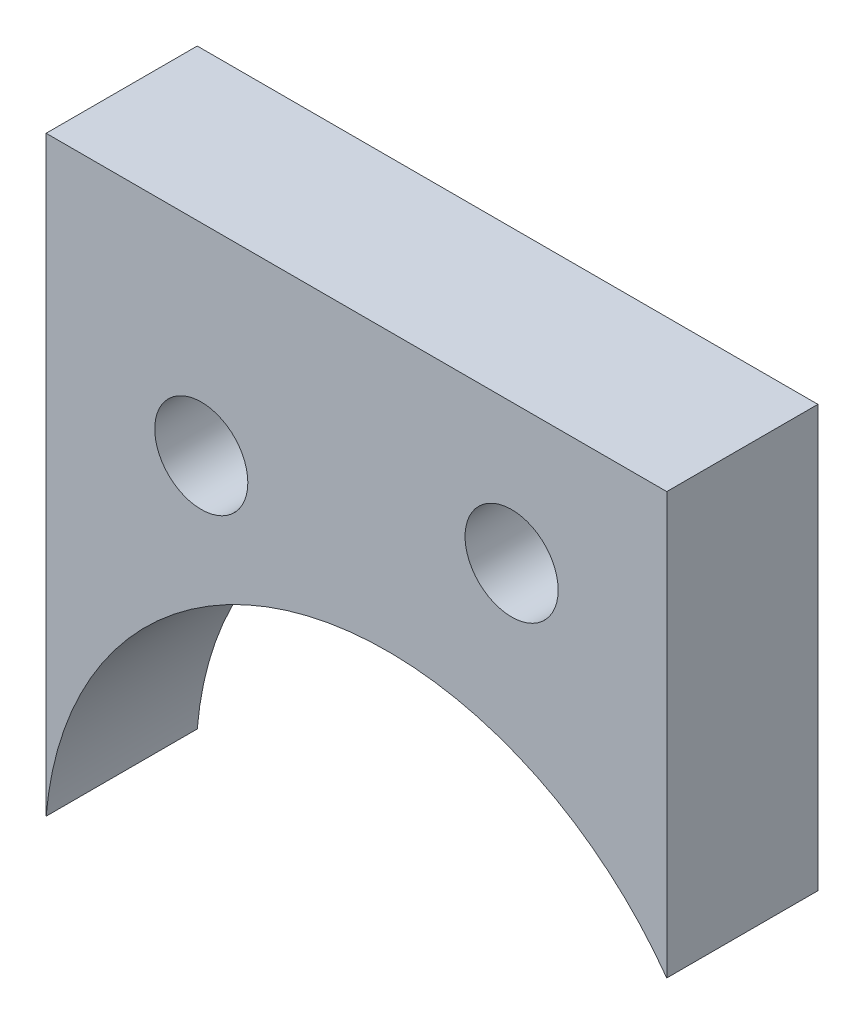
from build123d import *

# Parameters (mm, degrees)
SKETCH1_R           = 1.5
BOSS_EXTRUDE1_DEPTH = 4.87


with BuildPart() as part:
    # Sketch1 → Boss-Extrude1 (new body)
    with BuildSketch(Plane.XY):
        with BuildLine():
            Line((0, 0.939361485), (0, 20))
            Line((0, 20), (20, 20))
            Line((20, 20), (20, 6.425138131))
            ThreePointArc((20, 6.425138131), (8.087067166, 10.656404818), (0, 0.939361485))
        make_face()
        with Locations((5, 13.5)):
            Circle(SKETCH1_R, mode=Mode.SUBTRACT)
        with Locations((15, 15.5)):
            Circle(SKETCH1_R, mode=Mode.SUBTRACT)
    extrude(amount=BOSS_EXTRUDE1_DEPTH)


solid = part.part
